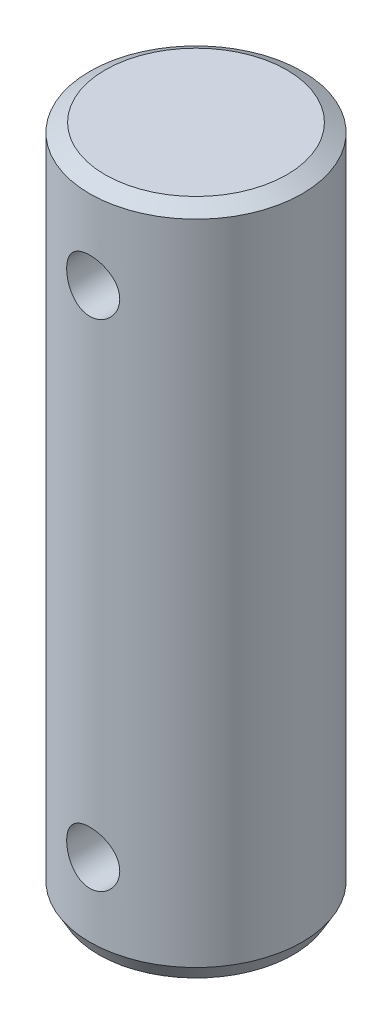
from build123d import *
from OCP.BRepFilletAPI import BRepFilletAPI_MakeChamfer

# Parameters (mm, degrees)
SKETCH1_R           = 6
BOSS_EXTRUDE1_DEPTH = 19
CHAMFER1_SIZE       = 0.5
CHAMFER1_SIZE2      = 0.866025404
SKETCH2_R           = 1.5
CUT_EXTRUDE1_DEPTH  = 19


with BuildPart() as part:
    # Sketch1 → Boss-Extrude1 (new, symmetric)
    with BuildSketch(Plane(origin=(0, 0, 0), x_dir=(1, 0, 0), z_dir=(0, 1, 0))):
        with Locations(Location((0, 0, 0), (0, 0, 270))):
            Circle(SKETCH1_R)
    extrude(amount=BOSS_EXTRUDE1_DEPTH, both=True)

    # Chamfer1: one chamfer whose edges measure the first distance from different faces: ONE call of the kernel's chamfer builder (chamfer() names one face for all edges)
    chamfer1_edges_1 = [part.edges().sort_by_distance(p)[0] for p in [
        (0, -19, -6),
    ]]
    chamfer1_side_1 = [part.faces().sort_by_distance(p)[0] for p in [
        (0, -19, 0),
    ]]
    chamfer1_edges_2 = [part.edges().sort_by_distance(p)[0] for p in [
        (0, 19, -6),
    ]]
    chamfer1_side_2 = [part.faces().sort_by_distance(p)[0] for p in [
        (0, 0, -6),
    ]]
    chamfer1 = BRepFilletAPI_MakeChamfer(part.part.solid().wrapped)
    for e in chamfer1_edges_1:
        chamfer1.Add(CHAMFER1_SIZE, CHAMFER1_SIZE2, e.wrapped, chamfer1_side_1[0].wrapped)  # the first distance lies on this face
    for e in chamfer1_edges_2:
        chamfer1.Add(CHAMFER1_SIZE, CHAMFER1_SIZE2, e.wrapped, chamfer1_side_2[0].wrapped)  # the first distance lies on this face
    add(Compound.cast(chamfer1.Shape()), mode=Mode.REPLACE)

    # Sketch2 → Cut-Extrude1 (cut, symmetric)
    with BuildSketch(Plane.XY):
        with Locations(Location((0, 14, 0), (0, 0, 90.000000004))):
            Circle(SKETCH2_R)
        with Locations(Location((0, -14, 0), (0, 0, 90.000000004))):
            Circle(SKETCH2_R)
    extrude(amount=CUT_EXTRUDE1_DEPTH, both=True, mode=Mode.SUBTRACT)


solid = part.part
